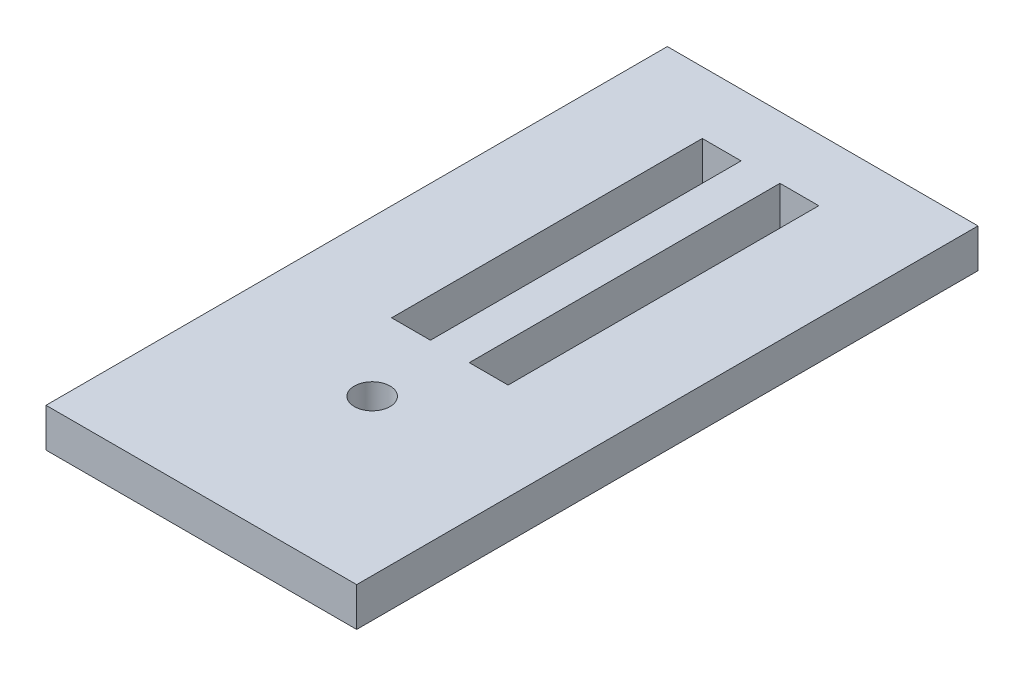
from build123d import *

# Parameters (mm, degrees)
SKETCH1_W           = 25.4
SKETCH1_H           = 50.8
SKETCH1_R           = 1.4605
SKETCH1_W_2         = 3.175
SKETCH1_H_2         = 25.4
BOSS_EXTRUDE1_DEPTH = 3.175


with BuildPart() as part:
    # Sketch1 → Boss-Extrude1 (new body)
    with BuildSketch(Plane(origin=(0, 0, 0), x_dir=(1, 0, 0), z_dir=(0, 1, 0))):
        with Locations((12.7, 25.4)):
            Rectangle(SKETCH1_W, SKETCH1_H)
        with Locations(Location((12.7, 13.97, 0), (0, 0, 270))):
            Circle(SKETCH1_R, mode=Mode.SUBTRACT)
        with Locations((9.525, 33.02)):
            Rectangle(SKETCH1_W_2, SKETCH1_H_2, mode=Mode.SUBTRACT)
        with Locations((15.875, 33.02)):
            Rectangle(SKETCH1_W_2, SKETCH1_H_2, mode=Mode.SUBTRACT)
    extrude(amount=BOSS_EXTRUDE1_DEPTH)


solid = part.part
